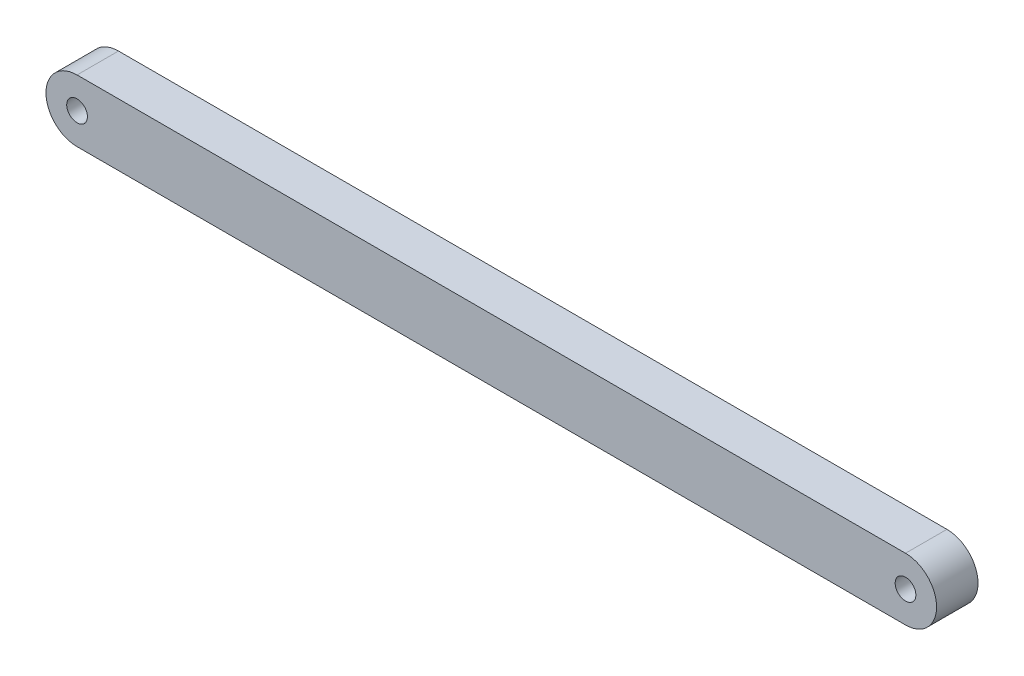
from build123d import *

# Parameters (mm, degrees)
SKETCH_1_R      = 0.5
EXTRUDE_1_DEPTH = 2


with BuildPart() as part:
    # 草图1 → 凸台-拉伸1 (new body)
    with BuildSketch(Plane.XY):
        with BuildLine():
            Line((-26.147603506, 22.01512969), (13.852396494, 22.01512969))
            ThreePointArc((13.852396494, 22.01512969), (15.352396494, 20.51512969), (13.852396494, 19.01512969))
            Line((13.852396494, 19.01512969), (-26.147603506, 19.01512969))
            ThreePointArc((-26.147603506, 19.01512969), (-27.647603506, 20.51512969), (-26.147603506, 22.01512969))
        make_face()
        with Locations((-26.147603506, 20.51512969)):
            Circle(SKETCH_1_R, mode=Mode.SUBTRACT)
        with Locations((13.852396494, 20.51512969)):
            Circle(SKETCH_1_R, mode=Mode.SUBTRACT)
    extrude(amount=EXTRUDE_1_DEPTH)


solid = part.part
